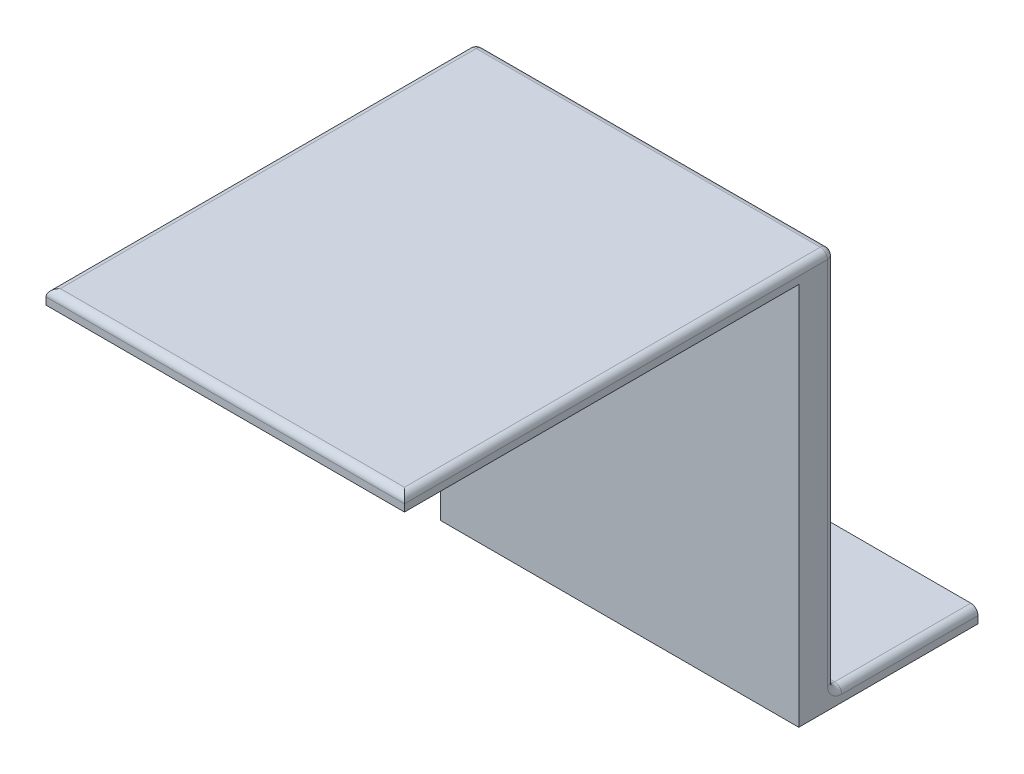
from build123d import *

# Parameters (mm, degrees)
SKETCH_1_W          = 50
SKETCH_1_H          = 55.5
EXTRUDE_1_DEPTH     = 60
SKETCH_3_W          = 50
SKETCH_3_H          = 53.5
CUT_EXTRUDE_1_DEPTH = 55
SKETCH_4_W          = 50
SKETCH_4_H          = 2
EXTRUDE_2_DEPTH     = 20
FILLET_5_R          = 1
SCALE_1_SCALE       = 1.7


with BuildPart() as part:
    # 草图1 → 凸台-拉伸1 (new body)
    with BuildSketch(Plane.XY):
        with Locations((6.818181818, -9.182037969)):
            Rectangle(SKETCH_1_W, SKETCH_1_H)
    extrude(amount=EXTRUDE_1_DEPTH)

    # 草图3 → 切除-拉伸1 (cut)
    with BuildSketch(Plane.XY.offset(60)):
        with Locations((6.818181818, -10.182037969)):
            Rectangle(SKETCH_3_W, SKETCH_3_H)
    extrude(amount=-CUT_EXTRUDE_1_DEPTH, mode=Mode.SUBTRACT)

    # 草图4 → 凸台-拉伸2 (add)
    with BuildSketch(Plane(origin=(0, 0, 0), x_dir=(-1, 0, 0), z_dir=(0, 0, -1))):
        with Locations((-6.818181818, -35.932037969)):
            Rectangle(SKETCH_4_W, SKETCH_4_H)
    extrude(amount=EXTRUDE_2_DEPTH)

    # 圆角5
    fillet_5_edges = [part.edges().sort_by_distance(p)[0] for p in [
        (6.818181818, 18.567962031, 60),
        (31.818181818, -8.182037969, 0),
        (6.818181818, -34.932037969, 0),
        (-18.181818182, -34.932037969, -10),
        (31.818181818, -34.932037969, -10),
        (6.818181818, 18.567962031, 0),
        (-18.181818182, -8.182037969, 0),
        (-18.181818182, 18.567962031, 30),
        (31.818181818, 18.567962031, 30),
    ]]
    fillet(fillet_5_edges, radius=FILLET_5_R)


with BuildPart() as part_1:
    # 缩放比例1: scaled about (0, 0, 0)
    add(part.part.scale(SCALE_1_SCALE))


solid = part_1.part
